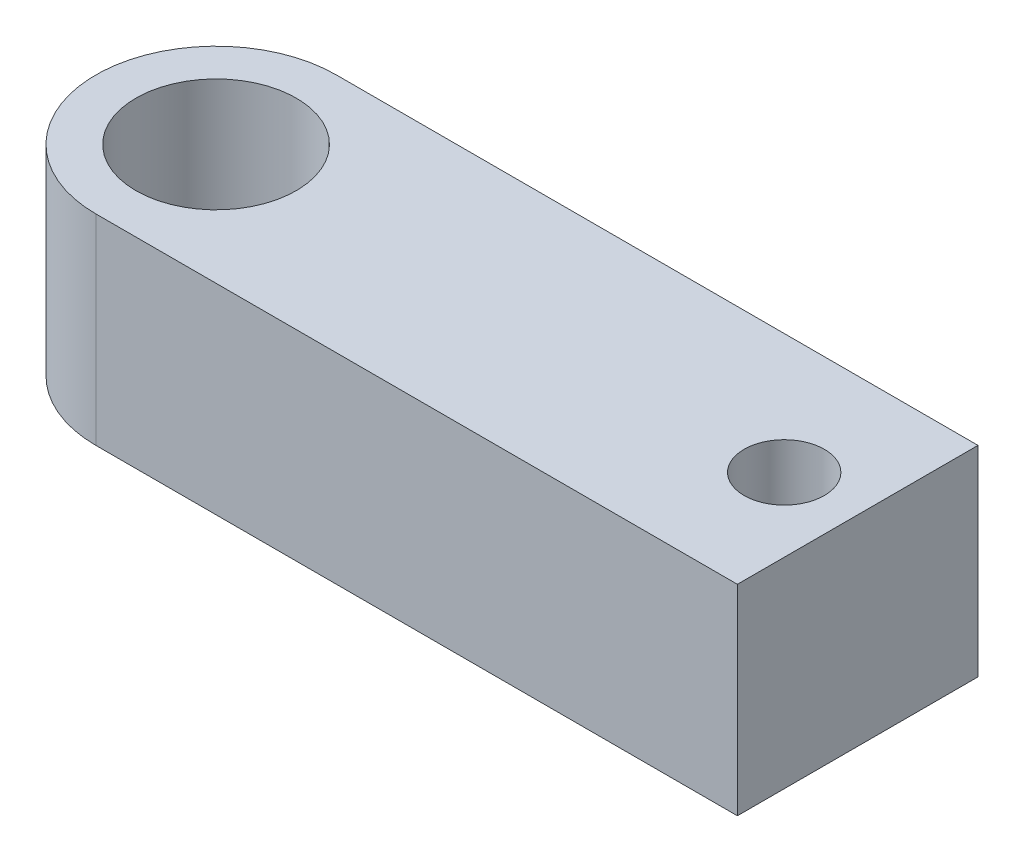
from build123d import *

# Parameters (mm, degrees)
EXTRUDE_1_DEPTH     = 5
SKETCH_3_R          = 2
CUT_EXTRUDE_1_DEPTH = 5
SKETCH_4_R          = 1
CUT_EXTRUDE_2_DEPTH = 5


with BuildPart() as part:
    # 草图2 → 凸台-拉伸1 (new body)
    with BuildSketch(Plane(origin=(0, 0, 0), x_dir=(1, 0, 0), z_dir=(0, 1, 0))):
        with BuildLine():
            Line((0, 3), (16, 3))
            Line((16, 3), (16, -3))
            Line((16, -3), (0, -3))
            ThreePointArc((0, -3), (-3, 0), (0, 3))
        make_face()
    extrude(amount=EXTRUDE_1_DEPTH)

    # 草图3 → 切除-拉伸1 (cut)
    with BuildSketch(Plane(origin=(0, 5, 0), x_dir=(1, 0, 0), z_dir=(0, 1, 0))):
        with Locations(Location((0, 0, 0), (0, 0, 270))):
            Circle(SKETCH_3_R)
    extrude(amount=-CUT_EXTRUDE_1_DEPTH, mode=Mode.SUBTRACT)

    # 草图4 → 切除-拉伸2 (cut)
    with BuildSketch(Plane(origin=(0, 5, 0), x_dir=(1, 0, 0), z_dir=(0, 1, 0))):
        with Locations(Location((14.167639534, 0, 0), (0, 0, 270))):
            Circle(SKETCH_4_R)
    extrude(amount=-CUT_EXTRUDE_2_DEPTH, mode=Mode.SUBTRACT)


solid = part.part
